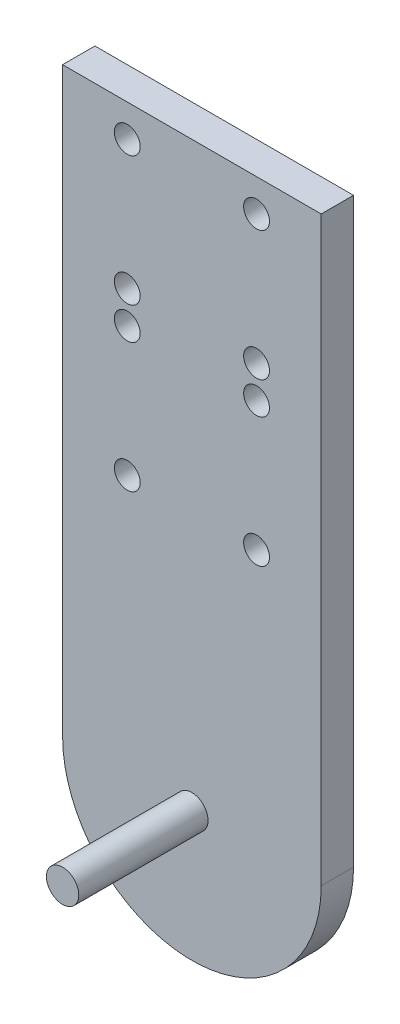
from build123d import *

# Parameters (mm, degrees)
BOSS_EXTRUDE1_DEPTH = 5
SKETCH2_R           = 2.5
BOSS_EXTRUDE2_DEPTH = 20
SKETCH3_R           = 2
CUT_EXTRUDE1_DEPTH  = 50
SKETCH5_R           = 2
CUT_EXTRUDE2_DEPTH  = 50
LPATTERN1_COUNT     = 2
LPATTERN1_PITCH     = 20


with BuildPart() as part:
    # Sketch1 → Boss-Extrude1 (new body)
    with BuildSketch(Plane.XY):
        with BuildLine():
            Line((-40, 90), (0, 90))
            Line((0, 90), (0, 0))
            ThreePointArc((0, 0), (-20, -20), (-40, 0))
            Line((-40, 0), (-40, 90))
        make_face()
    extrude(amount=BOSS_EXTRUDE1_DEPTH)

    # Sketch2 → Boss-Extrude2 (add)
    with BuildSketch(Plane.XY.offset(5)):
        with Locations((-20, 0)):
            Circle(SKETCH2_R)
    extrude(amount=BOSS_EXTRUDE2_DEPTH)

    # Sketch3 → Cut-Extrude1 (cut)
    with BuildSketch(Plane.XY.offset(5)):
        with Locations((-30, 85)):
            Circle(SKETCH3_R)
        with Locations((-10, 85)):
            Circle(SKETCH3_R)
    cut_extrude1 = extrude(amount=-CUT_EXTRUDE1_DEPTH, mode=Mode.SUBTRACT)

    # Sketch5 → Cut-Extrude2 (cut)
    with BuildSketch(Plane.XY.offset(5)):
        with Locations((-30, 60)):
            Circle(SKETCH5_R)
        with Locations((-10, 60)):
            Circle(SKETCH5_R)
    cut_extrude2 = extrude(amount=-CUT_EXTRUDE2_DEPTH, mode=Mode.SUBTRACT)

    # LPattern1: Cut-Extrude1, Cut-Extrude2 ×2
    with Locations(*[(0, -i * LPATTERN1_PITCH, 0) for i in range(1, LPATTERN1_COUNT)]):
        add(cut_extrude1, mode=Mode.SUBTRACT)
        add(cut_extrude2, mode=Mode.SUBTRACT)


solid = part.part
